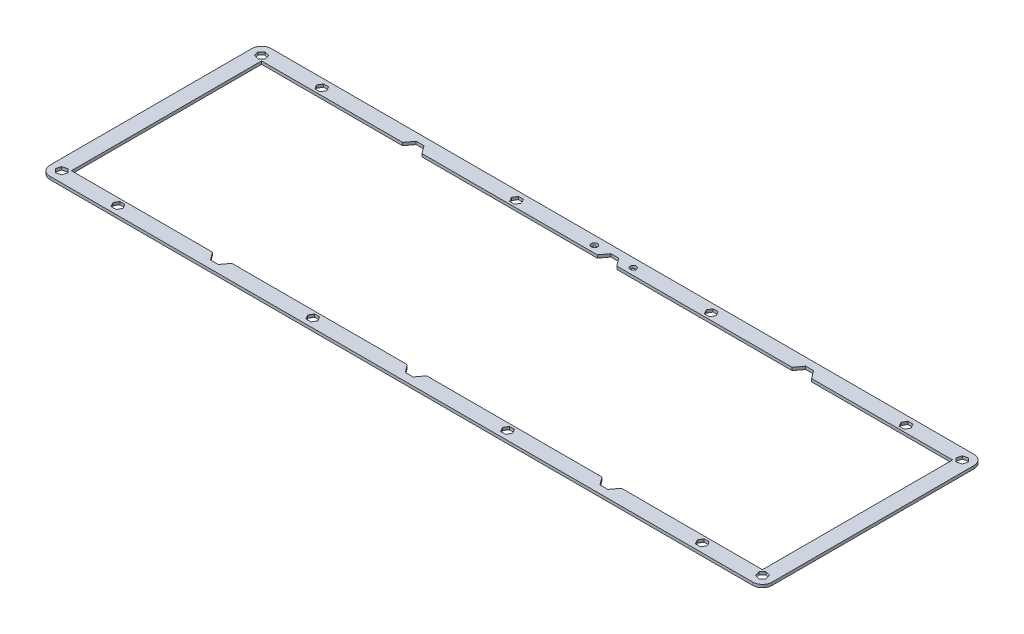
from build123d import *

# Parameters (mm, degrees)
SKETCH1_R           = 1.55
BOSS_EXTRUDE1_DEPTH = 1.5


with BuildPart() as part:
    # Sketch1 → Boss-Extrude1 (new body)
    with BuildSketch(Plane(origin=(0, 0, 0), x_dir=(1, 0, 0), z_dir=(0, 1, 0))):
        with BuildLine():
            Line((4.973e-06, 108.599999805), (4.973e-06, 4.999999805))
            ThreePointArc((4.973e-06, 4.999999805), (1.464471067, 1.464465899), (5.000004973, -1.95e-07))
            Line((5.000004973, -1.95e-07), (365.775004973, -1.95e-07))
            ThreePointArc((365.775004973, -1.95e-07), (369.310538879, 1.464465899), (370.775004973, 4.999999805))
            Line((370.775004973, 4.999999805), (370.775004973, 108.599999805))
            ThreePointArc((370.775004973, 108.599999805), (369.310538879, 112.135533711), (365.775004973, 113.599999805))
            Line((365.775004973, 113.599999805), (5.000004973, 113.599999805))
            ThreePointArc((5.000004973, 113.599999805), (1.464471067, 112.135533711), (4.973e-06, 108.599999805))
        make_face()
        with Locations(Location((175.387504973, 109.099999805, 0), (0, 0, 270))):
            Circle(SKETCH1_R, mode=Mode.SUBTRACT)
        with Locations(Location((195.387504973, 109.099999805, 0), (0, 0, 270))):
            Circle(SKETCH1_R, mode=Mode.SUBTRACT)
        Polygon((8.000004973, 7.999999805), (8.000004973, 105.599999805), (80.387504973, 105.599999805), (83.387504973, 109.599999805), (87.387504973, 109.599999805), (90.387504973, 105.599999805), (180.387504973, 105.599999805), (183.387504973, 109.599999805), (187.387504973, 109.599999805), (190.387504973, 105.599999805), (280.387504973, 105.599999805), (283.387504973, 109.599999805), (287.387504973, 109.599999805), (290.387504973, 105.599999805), (362.775004973, 105.599999805), (362.775004973, 7.999999805), (290.387504973, 7.999999805), (287.387504973, 3.999999805), (283.387504973, 3.999999805), (280.387504973, 7.999999805), (190.387504973, 7.999999805), (187.387504973, 3.999999805), (183.387504973, 3.999999805), (180.387504973, 7.999999805), (90.387504973, 7.999999805), (87.387504973, 3.999999805), (83.387504973, 3.999999805), (80.387504973, 7.999999805), align=None, mode=Mode.SUBTRACT)
        Polygon((234.088466868, 111.349999805), (236.686543079, 111.349999805), (237.985581185, 109.099999805), (236.686543079, 106.849999805), (234.088466868, 106.849999805), (232.789428762, 109.099999805), align=None, mode=Mode.SUBTRACT)
        Polygon((334.088466868, 111.349999805), (336.686543079, 111.349999805), (337.985581185, 109.099999805), (336.686543079, 106.849999805), (334.088466868, 106.849999805), (332.789428762, 109.099999805), align=None, mode=Mode.SUBTRACT)
        Polygon((365.947436577, 110.609548716), (367.784553885, 108.772431409), (367.11212228, 106.262882498), (364.602573369, 105.590450894), (362.765456062, 107.427568201), (363.437887666, 109.937117112), align=None, mode=Mode.SUBTRACT)
        Polygon((136.686543079, 111.349999805), (134.088466868, 111.349999805), (132.789428762, 109.099999805), (134.088466868, 106.849999805), (136.686543079, 106.849999805), (137.985581185, 109.099999805), align=None, mode=Mode.SUBTRACT)
        Polygon((36.686543079, 111.349999805), (34.088466868, 111.349999805), (32.789428762, 109.099999805), (34.088466868, 106.849999805), (36.686543079, 106.849999805), (37.985581185, 109.099999805), align=None, mode=Mode.SUBTRACT)
        Polygon((4.827573369, 110.609548716), (2.990456062, 108.772431409), (3.662887666, 106.262882498), (6.172436577, 105.590450894), (8.009553885, 107.427568201), (7.33712228, 109.937117112), align=None, mode=Mode.SUBTRACT)
        Polygon((234.088466868, 2.249999805), (236.686543079, 2.249999805), (237.985581185, 4.499999805), (236.686543079, 6.749999805), (234.088466868, 6.749999805), (232.789428762, 4.499999805), align=None, mode=Mode.SUBTRACT)
        Polygon((334.088466868, 2.249999805), (336.686543079, 2.249999805), (337.985581185, 4.499999805), (336.686543079, 6.749999805), (334.088466868, 6.749999805), (332.789428762, 4.499999805), align=None, mode=Mode.SUBTRACT)
        Polygon((365.947436577, 2.990450894), (367.784553885, 4.827568201), (367.11212228, 7.337117112), (364.602573369, 8.009548716), (362.765456062, 6.172431409), (363.437887666, 3.662882498), align=None, mode=Mode.SUBTRACT)
        Polygon((136.686543079, 2.249999805), (134.088466868, 2.249999805), (132.789428762, 4.499999805), (134.088466868, 6.749999805), (136.686543079, 6.749999805), (137.985581185, 4.499999805), align=None, mode=Mode.SUBTRACT)
        Polygon((36.686543079, 2.249999805), (34.088466868, 2.249999805), (32.789428762, 4.499999805), (34.088466868, 6.749999805), (36.686543079, 6.749999805), (37.985581185, 4.499999805), align=None, mode=Mode.SUBTRACT)
        Polygon((4.827573369, 2.990450894), (2.990456062, 4.827568201), (3.662887666, 7.337117112), (6.172436577, 8.009548716), (8.009553885, 6.172431409), (7.33712228, 3.662882498), align=None, mode=Mode.SUBTRACT)
    extrude(amount=-BOSS_EXTRUDE1_DEPTH)


solid = part.part
